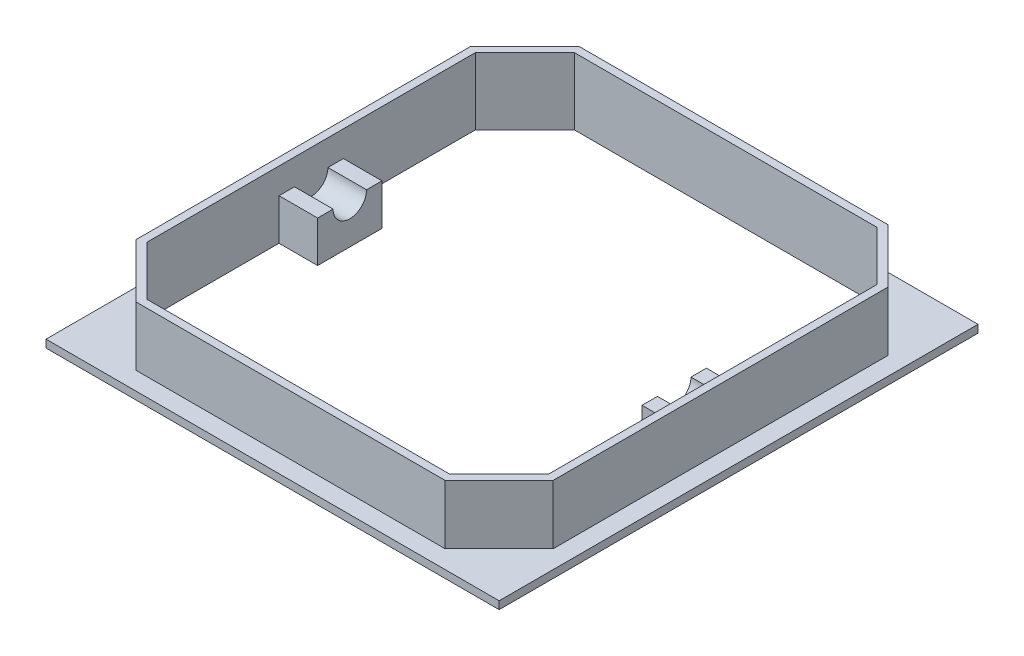
from build123d import *

# Parameters (mm, degrees)
SKETCH1_W           = 88
SKETCH1_H           = 93
BOSS_EXTRUDE1_DEPTH = 13
CUT_EXTRUDE1_DEPTH  = 11.5
CUT_EXTRUDE2_DEPTH  = 66.324191537
BOSS_EXTRUDE2_DEPTH = 7.5


with BuildPart() as part:
    # Sketch1 → Boss-Extrude1 (new body)
    with BuildSketch(Plane(origin=(0, 0, 0), x_dir=(1, 0, 0), z_dir=(0, 1, 0))):
        Rectangle(SKETCH1_W, SKETCH1_H)
    extrude(amount=BOSS_EXTRUDE1_DEPTH)

    # Sketch2 → Cut-Extrude1 (cut)
    with BuildSketch(Plane(origin=(0, 13, 0), x_dir=(1, 0, 0), z_dir=(0, 1, 0))):
        Polygon((-44, -36.5), (-44, -46.5), (-34, -46.5), (34, -46.5), (44, -46.5), (44, -36.5), (44, 36.5), (44, 46.5), (34, 46.5), (-34, 46.5), (-44, 46.5), (-44, 36.5), align=None)
        Polygon((-30, -43), (-40.5, -32.5), (-40.5, 32.5), (-30, 43), (30, 43), (40.5, 32.5), (40.5, -32.5), (30, -43), align=None, mode=Mode.SUBTRACT)
    extrude(amount=-CUT_EXTRUDE1_DEPTH, mode=Mode.SUBTRACT)

    # Sketch3 → Cut-Extrude2 (cut, through all)
    with BuildSketch(Plane(origin=(0, 13, 0), x_dir=(1, 0, 0), z_dir=(0, 1, 0))):
        Polygon((-29.378679656, -41.5), (29.378679656, -41.5), (39, -31.878679656), (39, 31.878679656), (29.378679656, 41.5), (-29.378679656, 41.5), (-39, 31.878679656), (-39, -31.878679656), align=None)
    extrude(amount=-CUT_EXTRUDE2_DEPTH, mode=Mode.SUBTRACT)

    # Sketch5 → Boss-Extrude2 (add)
    with BuildSketch(Plane(origin=(-39, 0, 0), x_dir=(0, 0, -1), z_dir=(1, 0, 0))):
        with BuildLine():
            Line((-6.25, 0), (6.25, 0))
            Line((6.25, 0), (6.25, 8))
            Line((6.25, 8), (3.25, 8))
            ThreePointArc((3.25, 8), (0, 4.75), (-3.25, 8))
            Line((-3.25, 8), (-6.25, 8))
            Line((-6.25, 8), (-6.25, 0))
        make_face()
    boss_extrude2 = extrude(amount=BOSS_EXTRUDE2_DEPTH)

    # Mirror1: Boss-Extrude2 across plane
    add(boss_extrude2.mirror(Plane(origin=(0, 0, 0), x_dir=(0, 0, 1), z_dir=(1, 0, 0))))


solid = part.part
